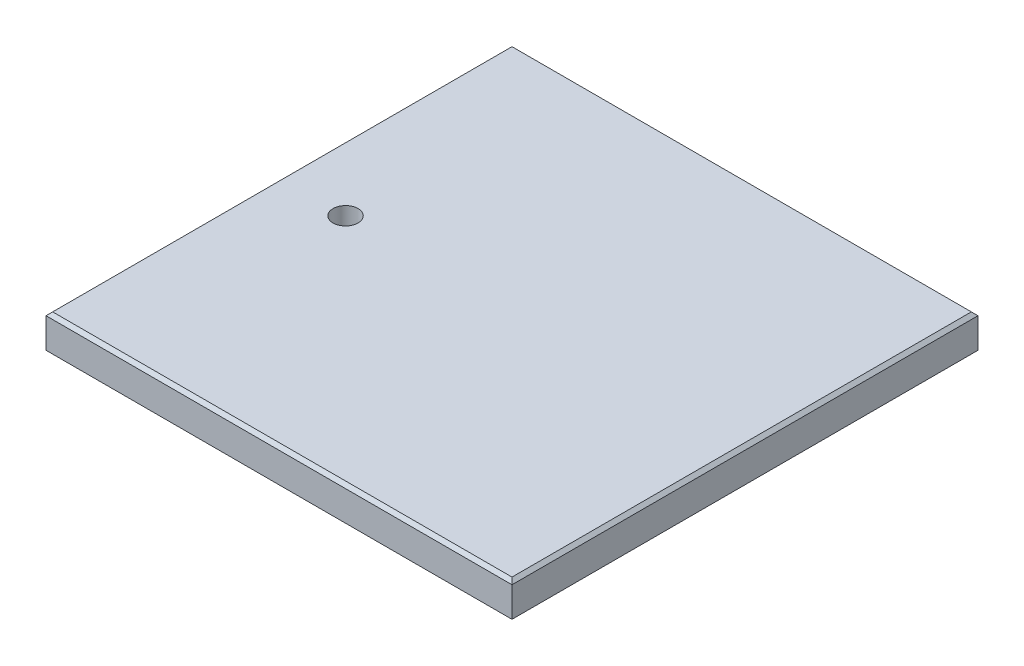
from build123d import *

# Parameters (mm, degrees)
SKETCH1_W           = 88.9
SKETCH1_H           = 88.9
BOSS_EXTRUDE1_DEPTH = 12.7
SKETCH2_OUTSIDE_W   = 116.172
SKETCH2_OUTSIDE_H   = 116.172
SKETCH2_OUTSIDE_W_2 = 76.2
SKETCH2_OUTSIDE_H_2 = 76.2
CUT_EXTRUDE3_DEPTH  = 6.35
SKETCH3_R           = 2.3876
CUT_EXTRUDE4_DEPTH  = 65.131856359
CHAMFER1_SIZE       = 0.635
SKETCH4_R           = 3.175
CUT_EXTRUDE5_DEPTH  = 7.62


with BuildPart() as part:
    # Sketch1 → Boss-Extrude1 (new body)
    with BuildSketch(Plane(origin=(0, 0, 0), x_dir=(1, 0, 0), z_dir=(0, 1, 0))):
        Rectangle(SKETCH1_W, SKETCH1_H)
    extrude(amount=BOSS_EXTRUDE1_DEPTH)

    # Sketch2 outside → Cut-Extrude3 (cut)
    with BuildSketch(Plane(origin=(0, 0, 0), x_dir=(1, 0, 0), z_dir=(0, 1, 0))):
        Rectangle(SKETCH2_OUTSIDE_W, SKETCH2_OUTSIDE_H)
        Rectangle(SKETCH2_OUTSIDE_W_2, SKETCH2_OUTSIDE_H_2, mode=Mode.SUBTRACT)
    extrude(amount=CUT_EXTRUDE3_DEPTH, mode=Mode.SUBTRACT)

    # Sketch3 → Cut-Extrude4 (cut, through all)
    with BuildSketch(Plane(origin=(0, 12.7, 0), x_dir=(1, 0, 0), z_dir=(0, 1, 0))):
        with Locations(Location((-31.75, 0, 0), (0, 0, 270))):
            Circle(SKETCH3_R)
    extrude(amount=-CUT_EXTRUDE4_DEPTH, mode=Mode.SUBTRACT)

    # Chamfer1
    chamfer1_edges = [part.edges().sort_by_distance(p)[0] for p in [
        (-44.45, 12.7, 0),
        (0, 12.7, 44.45),
        (44.45, 12.7, 0),
        (0, 12.7, -44.45),
    ]]
    chamfer(chamfer1_edges, length=CHAMFER1_SIZE)

    # Sketch4 → Cut-Extrude5 (cut)
    with BuildSketch(Plane.XZ):
        with Locations(Location((-31.75, 15.875, 0), (0, 0, 270))):
            Circle(SKETCH4_R)
        with Locations(Location((-31.75, -15.875, 0), (0, 0, 270))):
            Circle(SKETCH4_R)
    extrude(amount=-CUT_EXTRUDE5_DEPTH, mode=Mode.SUBTRACT)


solid = part.part
